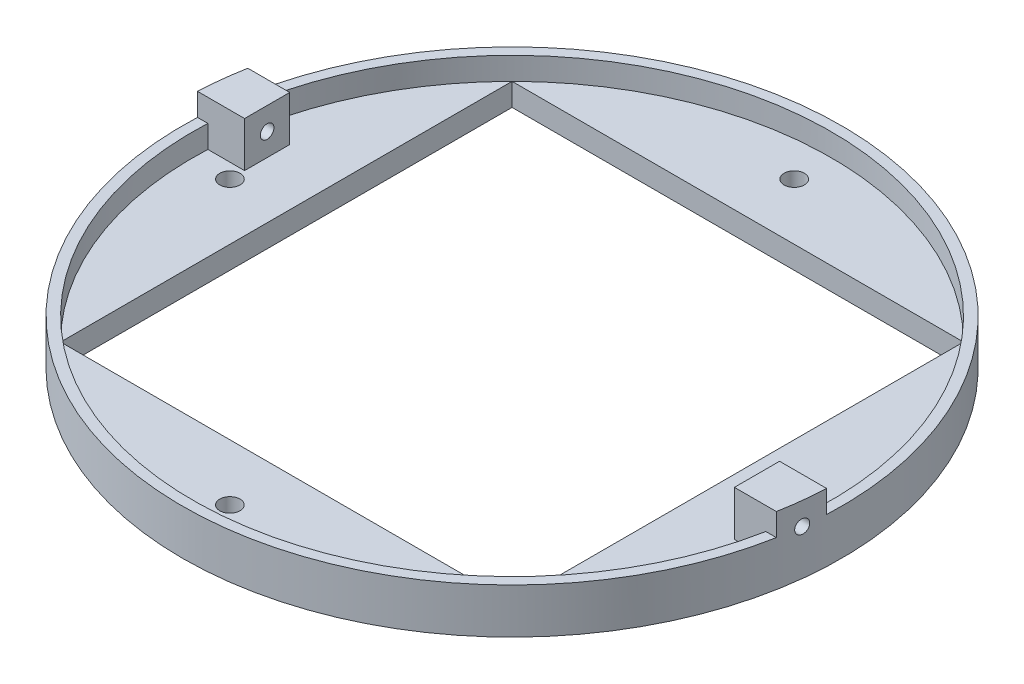
from build123d import *
from build123d.topology import SkipClean

# Parameters (mm, degrees)
SKETCH1_R           = 76
SKETCH1_W           = 100
SKETCH1_H           = 100
BOSS_EXTRUDE1_DEPTH = 5
SKETCH2_R           = 2.25
CUT_EXTRUDE1_DEPTH  = 10
SKETCH3_R           = 73
SKETCH3_R_2         = 70.710678119
BOSS_EXTRUDE2_DEPTH = 5
CUT_EXTRUDE2_START  = -5
SKETCH4_R           = 76
SKETCH4_R_2         = 73
CUT_EXTRUDE2_DEPTH  = 5
BOSS_EXTRUDE4_DEPTH = 10
CUT_EXTRUDE3_DEPTH  = 23
CUT_EXTRUDE4_DEPTH  = 21


with BuildPart() as part:
    # Sketch1 → Boss-Extrude1 (new body)
    with BuildSketch(Plane(origin=(0, 0, 0), x_dir=(1, 0, 0), z_dir=(0, 1, 0))):
        with Locations(Location((0, 0, 0), (0, 0, 270))):
            Circle(SKETCH1_R)
        Rectangle(SKETCH1_W, SKETCH1_H, mode=Mode.SUBTRACT)
    extrude(amount=BOSS_EXTRUDE1_DEPTH)

    # Sketch2 → Cut-Extrude1 (cut)
    with BuildSketch(Plane(origin=(0, 5, 0), x_dir=(1, 0, 0), z_dir=(0, 1, 0))):
        with Locations(Location((-62.5, 0, 0), (0, 0, 270))):
            Circle(SKETCH2_R)
        with Locations(Location((0, 62.5, 0), (0, 0, 270))):
            Circle(SKETCH2_R)
        with Locations(Location((62.5, 0, 0), (0, 0, 270))):
            Circle(SKETCH2_R)
        with Locations(Location((0, -62.5, 0), (0, 0, 270))):
            Circle(SKETCH2_R)
    extrude(amount=-CUT_EXTRUDE1_DEPTH, mode=Mode.SUBTRACT)

    # Sketch3 → Boss-Extrude2 (add)
    with BuildSketch(Plane(origin=(0, 5, 0), x_dir=(1, 0, 0), z_dir=(0, 1, 0))):
        with Locations(Location((0, 0, 0), (0, 0, 270))):
            Circle(SKETCH3_R)
        with Locations(Location((0, 0, 0), (0, 0, 135))):
            Circle(SKETCH3_R_2, mode=Mode.SUBTRACT)
    extrude(amount=BOSS_EXTRUDE2_DEPTH)

    # Sketch4 → Cut-Extrude2 (cut)
    with BuildSketch(Plane(origin=(0, 5, 0), x_dir=(1, 0, 0), z_dir=(0, 1, 0)).offset(CUT_EXTRUDE2_START)):
        Circle(SKETCH4_R)
        with Locations(Location((0, 0, 0), (0, 0, 270))):
            Circle(SKETCH4_R_2, mode=Mode.SUBTRACT)
    extrude(amount=CUT_EXTRUDE2_DEPTH, mode=Mode.SUBTRACT)

    # Sketch7 → Boss-Extrude4 (add)
    with SkipClean():  # the faces are left unmerged after this step: merging them gives an invalid solid
        with BuildSketch(Plane(origin=(0, 5, 0), x_dir=(1, 0, 0), z_dir=(0, 1, 0))):
            with BuildLine():
                ThreePointArc((-71.787446674, 13.25), (-72.530079982, 8.269673379), (-72.927618225, 3.25))
                Line((-72.927618225, 3.25), (-62.5, 3.25))
                Line((-62.5, 3.25), (-62.5, 13.25))
                Line((-62.5, 13.25), (-71.787446674, 13.25))
            make_face()
            with BuildLine():
                Line((72.927618225, -3.25), (62.5, -3.25))
                Line((62.5, -3.25), (62.5, -13.25))
                Line((62.5, -13.25), (71.787446674, -13.25))
                ThreePointArc((71.787446674, -13.25), (72.530079982, -8.269673379), (72.927618225, -3.25))
            make_face()
        extrude(amount=BOSS_EXTRUDE4_DEPTH)

    # Sketch8 → Cut-Extrude3 (cut)
    with SkipClean():  # the faces are left unmerged after this step: merging them gives an invalid solid
        with BuildSketch(Plane.ZY.offset(-62.5)):
            with BuildLine():
                ThreePointArc((9.75, 10), (9.310660172, 11.060660172), (8.25, 11.5))
                Line((8.25, 11.5), (8.25, 8.5))
                ThreePointArc((8.25, 8.5), (9.310660172, 8.939339828), (9.75, 10))
            make_face()
            with BuildLine():
                Line((8.25, 8.5), (8.25, 11.5))
                ThreePointArc((8.25, 11.5), (6.75, 10), (8.25, 8.5))
            make_face()
        extrude(amount=-CUT_EXTRUDE3_DEPTH, mode=Mode.SUBTRACT)

    # Sketch9 → Cut-Extrude4 (cut)
    with BuildSketch(Plane(origin=(-62.5, 0, 0), x_dir=(0, 0, -1), z_dir=(1, 0, 0))):
        with BuildLine():
            ThreePointArc((9.75, 10), (9.310660172, 11.060660172), (8.25, 11.5))
            Line((8.25, 11.5), (8.25, 8.5))
            ThreePointArc((8.25, 8.5), (9.310660172, 8.939339828), (9.75, 10))
        make_face()
        with BuildLine():
            Line((8.25, 8.5), (8.25, 11.5))
            ThreePointArc((8.25, 11.5), (6.75, 10), (8.25, 8.5))
        make_face()
    extrude(amount=-CUT_EXTRUDE4_DEPTH, mode=Mode.SUBTRACT)


solid = part.part
